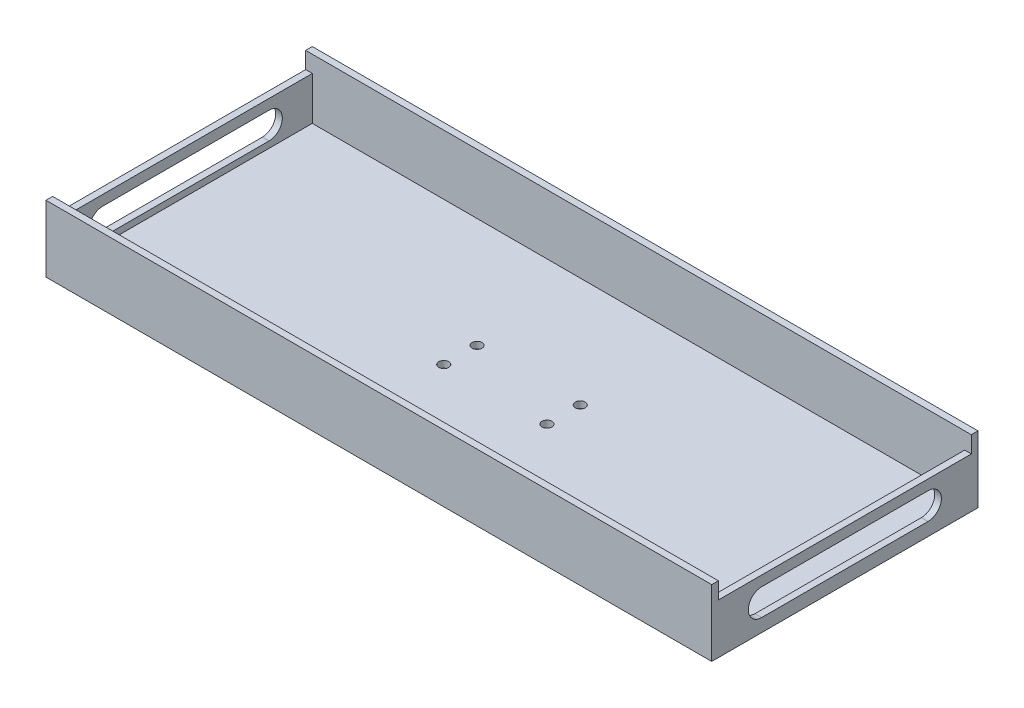
from build123d import *

# Parameters (mm, degrees)
IZIM4_W                     = 200
IZIM4_H                     = 80
Y_KSEKLIK_EKSTR_ZYON3_DEPTH = 10
BO_ALTMA1_T                 = -2
IZIM5_W                     = 76
IZIM5_H                     = 5
KES_EKSTR_ZYON1_DEPTH       = 200
IZIM8_R                     = 1.5
KES_EKSTR_ZYON3_DEPTH       = 39
KES_EKSTR_ZYON4_DEPTH       = 235
IZIM12_W                    = 1.794871794
IZIM12_H                    = 10
Y_KSEKLIK_EKSTR_ZYON4_DEPTH = 2
IZIM13_W                    = 1.794871794
IZIM13_H                    = 10
Y_KSEKLIK_EKSTR_ZYON5_DEPTH = 2


with BuildPart() as part:
    # Çizim4 → Yükseklik-Ekstrüzyon3 (new, symmetric)
    with BuildSketch(Plane(origin=(0, 0, 0), x_dir=(1, 0, 0), z_dir=(0, 1, 0))):
        with Locations((-100, 0)):
            Rectangle(IZIM4_W, IZIM4_H)
    extrude(amount=Y_KSEKLIK_EKSTR_ZYON3_DEPTH, both=True)

    # İç Boşaltma1
    bo_altma1_openings = [part.faces().sort_by_distance(p)[0] for p in [
        (-100, 10, 0),
    ]]
    offset(amount=BO_ALTMA1_T, openings=bo_altma1_openings, kind=Kind.INTERSECTION)

    # Çizim5 → Kes-Ekstrüzyon1 (cut)
    with BuildSketch(Plane(origin=(0, 0, 0), x_dir=(0, 0, -1), z_dir=(1, 0, 0))):
        with Locations((0, 7.5)):
            Rectangle(IZIM5_W, IZIM5_H)
    extrude(amount=-KES_EKSTR_ZYON1_DEPTH, mode=Mode.SUBTRACT)

    # Çizim8 → Kes-Ekstrüzyon3 (cut)
    with BuildSketch(Plane.XZ.offset(10)):
        with Locations(Location((-84.5, 5, 0), (0, 0, 270))):
            Circle(IZIM8_R)
        with Locations(Location((-84.5, -5, 0), (0, 0, 270))):
            Circle(IZIM8_R)
        with Locations(Location((-115.5, -5, 0), (0, 0, 270))):
            Circle(IZIM8_R)
        with Locations(Location((-115.5, 5, 0), (0, 0, 270))):
            Circle(IZIM8_R)
    extrude(amount=-KES_EKSTR_ZYON3_DEPTH, mode=Mode.SUBTRACT)

    # Çizim10 → Kes-Ekstrüzyon4 (cut)
    with BuildSketch(Plane(origin=(0, 0, 0), x_dir=(0, 0, -1), z_dir=(1, 0, 0))):
        with BuildLine():
            Line((25, -6.066336968), (10, -6.066336968))
            Line((10, -6.066336968), (-10, -6.066336968))
            Line((-10, -6.066336968), (-25, -6.066336968))
            ThreePointArc((-25, -6.066336968), (-29, -2.066336968), (-25, 1.933663032))
            Line((-25, 1.933663032), (-10, 1.933663032))
            Line((-10, 1.933663032), (10, 1.933663032))
            Line((10, 1.933663032), (25, 1.933663032))
            ThreePointArc((25, 1.933663032), (29, -2.066336968), (25, -6.066336968))
        make_face()
    extrude(amount=-KES_EKSTR_ZYON4_DEPTH, mode=Mode.SUBTRACT)

    # Çizim12 → Yükseklik-Ekstrüzyon4 (add)
    # profile 1 of 14: a face of its own
    with BuildSketch(Plane.XZ.offset(10)):
        with BuildLine():
            Line((-178.291749805, 30.263939108), (-179.607855574, 29.005926287))
            add(Edge.make_bspline(
                [(-179.607855574, 29.005926287), (-179.719498388, 29.121365144), (-179.937571779, 29.346853396), (-180.288970079, 29.64537997), (-180.654411516, 29.894161477), (-181.026787157, 30.103683678), (-181.41279496, 30.262202156), (-181.807971624, 30.377717241), (-182.214840468, 30.448142423), (-182.490193652, 30.45620031), (-182.628688908, 30.460253211)],
                knots=[0, 0, 0, 0, 1.115251505, 2.178435587, 3.19620269, 4.182487026, 5.141301733, 6.088180966, 7.038406374, 8, 8, 8, 8], degree=3))
            add(Edge.make_bspline(
                [(-182.628688908, 30.460253211), (-182.744349277, 30.457051277), (-182.972592272, 30.450732615), (-183.307712801, 30.404410586), (-183.628272906, 30.325637959), (-183.935369915, 30.217074689), (-184.228100182, 30.076599578), (-184.507077454, 29.904321353), (-184.771613922, 29.701795929), (-185.018215213, 29.470071183), (-185.243797408, 29.216894485), (-185.44311364, 28.946755551), (-185.610072957, 28.660273257), (-185.747093753, 28.360348882), (-185.853827656, 28.04559423), (-185.930049073, 27.716221205), (-185.974133504, 27.371837549), (-185.9807134, 27.137728106), (-185.984057497, 27.0187468)],
                knots=[0, 0, 0, 0, 1.035432265, 2.043311493, 3.022114605, 3.98653278, 4.95457646, 5.923598177, 6.917315552, 7.932509744, 8.948865224, 9.949768934, 10.933144597, 11.912367597, 12.897413939, 13.903909035, 14.934704909, 16, 16, 16, 16], degree=3))
            add(Edge.make_bspline(
                [(-185.984057497, 27.0187468), (-185.983093767, 26.935237395), (-185.981194234, 26.770638641), (-185.960400487, 26.527151402), (-185.926917652, 26.290911216), (-185.878459694, 26.062275926), (-185.817862541, 25.841047393), (-185.746768282, 25.625317091), (-185.657581581, 25.418065926), (-185.558582997, 25.21688681), (-185.443448784, 25.027269168), (-185.319312864, 24.84645301), (-185.184707725, 24.675324678), (-185.038761523, 24.51458375), (-184.879420247, 24.366742247), (-184.710802278, 24.227354398), (-184.530063265, 24.099909555), (-184.340957616, 23.981209348), (-184.141851696, 23.878093468), (-183.938147711, 23.784690402), (-183.726757097, 23.708833226), (-183.510253663, 23.647685421), (-183.289411116, 23.595688346), (-183.062069409, 23.563672148), (-182.830199312, 23.539426657), (-182.673494046, 23.537929639), (-182.59463442, 23.537176287)],
                knots=[0, 0, 0, 0, 1.103660481, 2.175337485, 3.227646561, 4.255952547, 5.262355991, 6.258840057, 7.255597736, 8.242457506, 9.22035537, 10.185017736, 11.140346927, 12.096287581, 13.051739095, 14.01125915, 14.986044842, 15.97314143, 16.960198552, 17.947847494, 18.933482797, 19.925264591, 20.920966487, 21.929612487, 22.958107872, 24, 24, 24, 24], degree=3))
            add(Edge.make_bspline(
                [(-182.59463442, 23.537176287), (-182.460874943, 23.541045321), (-182.198072354, 23.548646967), (-181.812371766, 23.608090758), (-181.444837531, 23.705872431), (-181.151179436, 23.821346906), (-180.921106075, 23.935379448), (-180.745954627, 24.040853934), (-180.564834378, 24.158838728), (-180.380753581, 24.293786702), (-180.191641693, 24.444078427), (-180.000836973, 24.613005573), (-179.803454787, 24.79500561), (-179.674151674, 24.924902613), (-179.607855574, 24.991503211)],
                knots=[0, 0, 0, 0, 1.404581149, 2.759636711, 4.088442092, 5.392261763, 6.066678138, 6.783632037, 7.538459478, 8.336747902, 9.180226004, 10.074962426, 11.012997595, 12, 12, 12, 12], degree=3))
            Line((-179.607855574, 24.991503211), (-178.331813908, 23.65135898))
            add(Edge.make_bspline(
                [(-178.331813908, 23.65135898), (-178.421512768, 23.564757546), (-178.596585762, 23.395730067), (-178.860678512, 23.155726819), (-179.124438892, 22.940057221), (-179.381494999, 22.740893412), (-179.63605768, 22.564037516), (-179.88809994, 22.409312906), (-180.134768551, 22.272806373), (-180.381185664, 22.156820031), (-180.628884615, 22.058335581), (-180.883737727, 21.973546934), (-181.146524109, 21.901818789), (-181.418848742, 21.843943596), (-181.698171547, 21.797535504), (-181.987106614, 21.76621031), (-182.283821952, 21.745151425), (-182.485088563, 21.74325911), (-182.5866216, 21.742304493)],
                knots=[0, 0, 0, 0, 1.244526981, 2.429050516, 3.560637417, 4.644440555, 5.67424972, 6.652764056, 7.595344123, 8.486817594, 9.369275933, 10.254498637, 11.166417451, 12.086725134, 13.032340136, 13.991389299, 14.986715468, 16, 16, 16, 16], degree=3))
            add(Edge.make_bspline(
                [(-182.5866216, 21.742304493), (-182.773125211, 21.747058842), (-183.138060937, 21.756361781), (-183.672864727, 21.825290264), (-184.180913972, 21.94084765), (-184.66344466, 22.104277668), (-185.120303358, 22.313051857), (-185.551373187, 22.568999209), (-185.955959359, 22.871439713), (-186.330793614, 23.216828472), (-186.669849036, 23.598281361), (-186.969534765, 24.007857116), (-187.217434811, 24.447568651), (-187.423271561, 24.910920024), (-187.584233192, 25.400025685), (-187.697522893, 25.915414699), (-187.767387825, 26.456589425), (-187.775031148, 26.826224238), (-187.778929292, 27.01474039)],
                knots=[0, 0, 0, 0, 1.078019885, 2.10938526, 3.111377082, 4.085535484, 5.04941344, 6.010039228, 6.978205633, 7.964457913, 8.951525778, 9.924444315, 10.892603023, 11.863865945, 12.85144698, 13.863884204, 14.910567087, 16, 16, 16, 16], degree=3))
            add(Edge.make_bspline(
                [(-187.778929292, 27.01474039), (-187.777282125, 27.137689016), (-187.774017843, 27.381343144), (-187.739709937, 27.740265414), (-187.69188272, 28.090150426), (-187.616009189, 28.427365214), (-187.524551131, 28.756452683), (-187.410811019, 29.073836037), (-187.274970513, 29.380427467), (-187.121408072, 29.676740226), (-186.947684419, 29.960833149), (-186.753616027, 30.230265427), (-186.544198973, 30.487117031), (-186.314401307, 30.727980345), (-186.06756229, 30.954970198), (-185.802567472, 31.166856487), (-185.521010665, 31.3666779), (-185.222129798, 31.549281529), (-184.911731332, 31.714456218), (-184.593730206, 31.860147347), (-184.268907714, 31.981911582), (-183.938637234, 32.082910522), (-183.601523378, 32.15829909), (-183.259972378, 32.215365803), (-182.911078046, 32.247266461), (-182.676825727, 32.252488803), (-182.558576728, 32.255125005)],
                knots=[0, 0, 0, 0, 1.071919942, 2.124283339, 3.142214191, 4.149696895, 5.136002878, 6.119640489, 7.086990633, 8.058538607, 9.028339693, 9.988281803, 10.952401235, 11.916291999, 12.888973767, 13.874849856, 14.873389453, 15.898127285, 16.927174885, 17.938320013, 18.946391617, 19.950418109, 20.947802303, 21.956882652, 22.968648068, 24, 24, 24, 24], degree=3))
            add(Edge.make_bspline(
                [(-182.558576728, 32.255125005), (-182.457698207, 32.253613868), (-182.256990022, 32.250607305), (-181.958101853, 32.225544332), (-181.661604052, 32.186183187), (-181.368558172, 32.126795601), (-181.076868049, 32.056295032), (-180.790366818, 31.963984261), (-180.504534768, 31.861086511), (-180.223854749, 31.738093261), (-179.947934973, 31.603835019), (-179.683239296, 31.451514168), (-179.425323501, 31.290504363), (-179.179902849, 31.111276338), (-178.942380081, 30.920331026), (-178.713997225, 30.716777562), (-178.496758474, 30.49722211), (-178.360431496, 30.342093223), (-178.291749805, 30.263939108)],
                knots=[0, 0, 0, 0, 0.996412454, 1.982464992, 2.961075852, 3.949442424, 4.934965278, 5.923860011, 6.921385422, 7.934793307, 8.949617135, 9.951082467, 10.950285876, 11.951772932, 12.951063433, 13.960125323, 14.972308753, 16, 16, 16, 16], degree=3))
        make_face()
    # profile 2 of 14: a face of its own
    with BuildSketch(Plane.XZ.offset(10)):
        with BuildLine():
            Line((-176.49687801, 31.998714749), (-174.405531856, 31.998714749))
            add(Edge.make_bspline(
                [(-174.405531856, 31.998714749), (-174.267294512, 31.998224086), (-174.00142516, 31.997280402), (-173.618056075, 31.982391574), (-173.26587885, 31.961672549), (-172.944372052, 31.930054765), (-172.653673229, 31.888133406), (-172.393491031, 31.838715061), (-172.163833065, 31.782392262), (-171.962762481, 31.712209611), (-171.781306223, 31.633044644), (-171.612163762, 31.542082646), (-171.451603566, 31.440336506), (-171.300698806, 31.325129009), (-171.158138083, 31.198532709), (-171.023652448, 31.060420175), (-170.899142309, 30.909620269), (-170.785378637, 30.747085855), (-170.681692207, 30.576103378), (-170.59005515, 30.396438079), (-170.515535742, 30.207965012), (-170.449689858, 30.013408021), (-170.4022632, 29.809985875), (-170.369278654, 29.599678924), (-170.345128659, 29.381746863), (-170.34374015, 29.233693498), (-170.343031856, 29.158169877)],
                knots=[0, 0, 0, 0, 1.749336639, 3.364467119, 4.854658419, 6.213483162, 7.451590619, 8.570285859, 9.5643256, 10.440900261, 11.26203566, 12.067320669, 12.869050712, 13.665104639, 14.467235401, 15.27997916, 16.102287765, 16.939272006, 17.78853747, 18.631303466, 19.488103222, 20.351255419, 21.228522269, 22.127379805, 23.044756219, 24, 24, 24, 24], degree=3))
            add(Edge.make_bspline(
                [(-170.343031856, 29.158169877), (-170.344871748, 29.079340567), (-170.348479441, 28.924770657), (-170.367912437, 28.697720066), (-170.403429849, 28.480493941), (-170.457226136, 28.273728296), (-170.519057981, 28.074849689), (-170.601278474, 27.887527555), (-170.694072426, 27.709037567), (-170.804281092, 27.541904531), (-170.92522972, 27.38241609), (-171.065890429, 27.236682836), (-171.217150566, 27.096872161), (-171.387513016, 26.97174133), (-171.569468043, 26.852829448), (-171.766630901, 26.745063616), (-171.977714839, 26.645734848), (-172.126117301, 26.590342266), (-172.202006215, 26.562016031)],
                knots=[0, 0, 0, 0, 1.099860209, 2.156625411, 3.176576793, 4.16617041, 5.135385252, 6.078461593, 7.016046972, 7.938469504, 8.868247731, 9.803980173, 10.76021508, 11.73834243, 12.748633912, 13.790971185, 14.870363756, 16, 16, 16, 16], degree=3))
            Line((-172.202006215, 26.562016031), (-169.894313908, 21.998714749))
            Line((-169.894313908, 21.998714749), (-171.889506215, 21.998714749))
            Line((-171.889506215, 21.998714749), (-174.093031856, 26.357689108))
            Line((-174.093031856, 26.357689108), (-174.702006215, 26.357689108))
            Line((-174.702006215, 26.357689108), (-174.702006215, 21.998714749))
            Line((-174.702006215, 21.998714749), (-176.49687801, 21.998714749))
            Line((-176.49687801, 21.998714749), (-176.49687801, 31.998714749))
        make_face()
        with BuildLine():
            Line((-174.702006215, 28.152560903), (-174.002887625, 28.152560903))
            add(Edge.make_bspline(
                [(-174.002887625, 28.152560903), (-173.917414566, 28.153523558), (-173.753752024, 28.155366835), (-173.518383793, 28.163916721), (-173.304613307, 28.18451772), (-173.111522563, 28.210546312), (-172.938139946, 28.24060008), (-172.786011968, 28.283668955), (-172.65279457, 28.329818345), (-172.540066381, 28.387170065), (-172.443754007, 28.45239141), (-172.360594437, 28.526484479), (-172.291809548, 28.612237772), (-172.235196077, 28.707320884), (-172.191156951, 28.812574802), (-172.159011763, 28.926844077), (-172.141047356, 29.051430383), (-172.13898049, 29.137411897), (-172.137903651, 29.182208339)],
                knots=[0, 0, 0, 0, 1.688639943, 3.233382647, 4.650958383, 5.928841754, 7.082724185, 8.122798841, 9.049171256, 9.863274652, 10.613301712, 11.341792392, 12.054588806, 12.776240173, 13.521029143, 14.301969904, 15.115324896, 16, 16, 16, 16], degree=3))
            add(Edge.make_bspline(
                [(-172.137903651, 29.182208339), (-172.139939514, 29.235205799), (-172.143938589, 29.339309489), (-172.183621839, 29.489182299), (-172.246789001, 29.627899839), (-172.333373879, 29.754835349), (-172.442416276, 29.866115779), (-172.56755103, 29.964210364), (-172.71147885, 30.041776223), (-172.844745181, 30.092937837), (-172.965986392, 30.123548359), (-173.075402761, 30.146359049), (-173.202107574, 30.162525639), (-173.346196487, 30.179673186), (-173.507302213, 30.190792503), (-173.686302874, 30.198907387), (-173.882684381, 30.202227585), (-174.019580944, 30.203288994), (-174.091028651, 30.203842954)],
                knots=[0, 0, 0, 0, 1.020303359, 2.004196876, 2.966617323, 3.9489082, 4.950758222, 5.960522915, 7.003732012, 8.091992268, 8.70421221, 9.413913587, 10.24622431, 11.166358409, 12.212345909, 13.359657661, 14.621978493, 16, 16, 16, 16], degree=3))
            Line((-174.091028651, 30.203842954), (-174.702006215, 30.203842954))
            Line((-174.702006215, 30.203842954), (-174.702006215, 28.152560903))
        make_face(mode=Mode.SUBTRACT)
    # profile 3 of 14: a face of its own
    with BuildSketch(Plane.XZ.offset(10)):
        Polygon((-168.419954933, 31.998714749), (-163.035339549, 31.998714749), (-163.035339549, 30.203842954), (-166.625083138, 30.203842954), (-166.625083138, 28.280766031), (-163.035339549, 28.280766031), (-163.035339549, 26.485894236), (-166.625083138, 26.485894236), (-166.625083138, 23.793586544), (-163.035339549, 23.793586544), (-163.035339549, 21.998714749), (-168.419954933, 21.998714749), align=None)
    # profile 4 of 14: a face of its own
    with BuildSketch(Plane.XZ.offset(10)):
        Polygon((-158.161541472, 31.998714749), (-156.49687801, 31.998714749), (-152.458416472, 21.998714749), (-154.375483779, 21.998714749), (-155.152727369, 24.0499968), (-159.509698523, 24.0499968), (-160.286942113, 21.998714749), (-162.202006215, 21.998714749), align=None)
        Polygon((-157.330211343, 29.316423082), (-158.828608779, 25.844868595), (-155.831813908, 25.844868595), align=None, mode=Mode.SUBTRACT)
    # profile 5 of 14: a face of its own
    with BuildSketch(Plane.XZ.offset(10)):
        Polygon((-152.009698523, 31.998714749), (-146.625083138, 31.998714749), (-146.625083138, 30.203842954), (-148.419954933, 30.203842954), (-148.419954933, 21.998714749), (-150.214826728, 21.998714749), (-150.214826728, 30.203842954), (-152.009698523, 30.203842954), align=None)
    # profile 6 of 14: a face of its own
    with BuildSketch(Plane.XZ.offset(10)):
        with Locations((-144.573801087, 26.998714749)):
            Rectangle(IZIM12_W, IZIM12_H)
    # profile 7 of 14: a face of its own
    with BuildSketch(Plane.XZ.offset(10)):
        with BuildLine():
            add(Edge.make_bspline(
                [(-144.513704933, 34.691022441), (-144.448573747, 34.687596772), (-144.32145146, 34.680910591), (-144.138823558, 34.627135952), (-143.972712886, 34.536467534), (-143.82691729, 34.412236182), (-143.703337377, 34.266790801), (-143.611996241, 34.102498099), (-143.558484735, 33.922404318), (-143.551646248, 33.797278289), (-143.548160061, 33.73349039)],
                knots=[0, 0, 0, 0, 1.033757622, 2.017676021, 2.99585523, 4.020311853, 5.044768476, 6.013636162, 6.987373143, 8, 8, 8, 8], degree=3))
            add(Edge.make_bspline(
                [(-143.548160061, 33.73349039), (-143.55155744, 33.668345343), (-143.558188405, 33.541196004), (-143.612529963, 33.358194509), (-143.702133117, 33.190893129), (-143.826405404, 33.044680627), (-143.97338128, 32.922666942), (-144.138746843, 32.831733878), (-144.321471826, 32.778083419), (-144.448580646, 32.771380013), (-144.513704933, 32.767945518)],
                knots=[0, 0, 0, 0, 1.028208009, 2.006844351, 2.989059939, 4.008016881, 5.020227687, 5.993155649, 6.971791991, 8, 8, 8, 8], degree=3))
            add(Edge.make_bspline(
                [(-144.513704933, 32.767945518), (-144.577499292, 32.771412703), (-144.702637991, 32.778213916), (-144.883206847, 32.832165769), (-145.04791471, 32.922722718), (-145.195114112, 33.044039954), (-145.317070933, 33.191600732), (-145.406970705, 33.358108428), (-145.46118124, 33.541218766), (-145.467830323, 33.668353054), (-145.471236984, 33.73349039)],
                knots=[0, 0, 0, 0, 1.011983718, 1.98510226, 2.962660208, 3.97968794, 4.996715672, 5.983605444, 6.966898937, 8, 8, 8, 8], degree=3))
            add(Edge.make_bspline(
                [(-145.471236984, 33.73349039), (-145.467741767, 33.797270798), (-145.460885567, 33.922382132), (-145.407502791, 34.102582703), (-145.315879569, 34.266092617), (-145.194608785, 34.412883389), (-145.048583022, 34.536412085), (-144.883130961, 34.626705118), (-144.702657812, 34.680779398), (-144.577505985, 34.687563817), (-144.513704933, 34.691022441)],
                knots=[0, 0, 0, 0, 1.017471896, 1.995867844, 2.969371198, 3.991914463, 5.021272727, 6.004132156, 6.982528104, 8, 8, 8, 8], degree=3))
        make_face()
    # profile 8 of 14: a face of its own
    with BuildSketch(Plane.XZ.offset(10)):
        Polygon((-141.368672882, 31.998714749), (-139.752086343, 31.998714749), (-135.214826728, 25.418185903), (-135.214826728, 31.998714749), (-133.419954933, 31.998714749), (-133.419954933, 21.998714749), (-135.048560702, 21.998714749), (-139.573801087, 28.559211544), (-139.573801087, 21.998714749), (-141.368672882, 21.998714749), align=None)
    # profile 9 of 14: a face of its own
    with BuildSketch(Plane.XZ.offset(10)):
        Polygon((-131.945595959, 31.998714749), (-129.948400446, 31.998714749), (-128.163544677, 28.49110257), (-126.378688908, 31.998714749), (-124.381493395, 31.998714749), (-127.266108779, 26.329644236), (-127.266108779, 21.998714749), (-129.060980574, 21.998714749), (-129.060980574, 26.329644236), align=None)
    # profile 10 of 14: a face of its own
    with BuildSketch(Plane.XZ.offset(10)):
        Polygon((-69.443592754, 31.998714749), (-67.778929292, 31.998714749), (-63.740467754, 21.998714749), (-65.657535061, 21.998714749), (-66.434778651, 24.0499968), (-70.791749805, 24.0499968), (-71.568993395, 21.998714749), (-73.484057497, 21.998714749), align=None)
        Polygon((-68.612262625, 29.316423082), (-70.110660061, 25.844868595), (-67.11386519, 25.844868595), align=None, mode=Mode.SUBTRACT)
    # profile 11 of 14: a face of its own
    with BuildSketch(Plane.XZ.offset(10)):
        with BuildLine():
            Line((-62.266108779, 31.998714749), (-60.00449019, 31.998714749))
            add(Edge.make_bspline(
                [(-60.00449019, 31.998714749), (-59.828171007, 31.997482218), (-59.487344034, 31.99509972), (-58.993553178, 31.968254707), (-58.534390517, 31.926968981), (-58.109560067, 31.870172984), (-57.719932799, 31.795016327), (-57.366011129, 31.70074703), (-57.046607211, 31.59192881), (-56.758218848, 31.463882093), (-56.49494801, 31.314592338), (-56.244963948, 31.148295536), (-56.008757498, 30.958899749), (-55.783013877, 30.750058801), (-55.570646354, 30.517952009), (-55.368118249, 30.266423903), (-55.18038837, 29.991826979), (-55.001782047, 29.700745204), (-54.840256395, 29.391945003), (-54.699367685, 29.068054818), (-54.581344358, 28.731159003), (-54.485444294, 28.380898515), (-54.409000874, 28.018436111), (-54.355514954, 27.643040378), (-54.322449426, 27.255058869), (-54.319095205, 26.99210475), (-54.317390831, 26.85849039)],
                knots=[0, 0, 0, 0, 1.44355588, 2.790409838, 4.047694926, 5.217575253, 6.298404546, 7.294384826, 8.214239204, 9.058592145, 9.873746385, 10.689560431, 11.514393297, 12.350027578, 13.205127629, 14.088021785, 14.991911688, 15.926770944, 16.882954281, 17.842803888, 18.816321264, 19.80318086, 20.814351908, 21.847355356, 22.906180909, 24, 24, 24, 24], degree=3))
            add(Edge.make_bspline(
                [(-54.317390831, 26.85849039), (-54.321853802, 26.669951832), (-54.330639421, 26.298802643), (-54.404644574, 25.754145484), (-54.524335965, 25.232037274), (-54.692632931, 24.736562147), (-54.901276117, 24.272132379), (-55.150523767, 23.846937997), (-55.436721328, 23.463261228), (-55.756534584, 23.123012467), (-56.102814449, 22.830564046), (-56.462669057, 22.580103375), (-56.839604047, 22.382594236), (-57.171736452, 22.257343907), (-57.459736682, 22.179449038), (-57.712597769, 22.133412421), (-57.999822163, 22.091194066), (-58.324087983, 22.05856863), (-58.683972744, 22.029474758), (-59.080910952, 22.013666281), (-59.513617435, 22.000531783), (-59.814173, 21.999336297), (-59.970435702, 21.998714749)],
                knots=[0, 0, 0, 0, 1.315458931, 2.589557908, 3.828601765, 5.048913369, 6.235739168, 7.376350998, 8.481830359, 9.569842114, 10.627874879, 11.640079404, 12.624025415, 13.590060155, 14.111227486, 14.704434459, 15.382649715, 16.137166398, 16.978595427, 17.902333227, 18.909396075, 20, 20, 20, 20], degree=3))
            Line((-59.970435702, 21.998714749), (-62.266108779, 21.998714749))
            Line((-62.266108779, 21.998714749), (-62.266108779, 31.998714749))
        make_face()
        with BuildLine():
            Line((-60.471236984, 30.203842954), (-60.471236984, 23.793586544))
            Line((-60.471236984, 23.793586544), (-59.533736984, 23.793586544))
            add(Edge.make_bspline(
                [(-59.533736984, 23.793586544), (-59.422188882, 23.793790946), (-59.207644747, 23.79418408), (-58.89789158, 23.812909376), (-58.611448441, 23.83170441), (-58.349103841, 23.867378013), (-58.108948517, 23.907115897), (-57.894281575, 23.962416602), (-57.700677795, 24.020505309), (-57.530502012, 24.094459433), (-57.37463486, 24.177699721), (-57.230319681, 24.275225368), (-57.091015129, 24.383523922), (-56.959325613, 24.505780596), (-56.834752721, 24.640376482), (-56.718033506, 24.788005094), (-56.607610074, 24.948216012), (-56.506316785, 25.12185631), (-56.413754436, 25.307092309), (-56.33164126, 25.502129727), (-56.263557321, 25.708592807), (-56.206970118, 25.924548804), (-56.166532146, 26.151877862), (-56.133077437, 26.388896186), (-56.115830559, 26.636542822), (-56.113463533, 26.80504987), (-56.112262625, 26.890541672)],
                knots=[0, 0, 0, 0, 1.50275155, 2.890291501, 4.180787663, 5.369391935, 6.45668281, 7.458360028, 8.354766181, 9.177074746, 9.954075863, 10.732690366, 11.5210699, 12.329727389, 13.151100085, 13.990027547, 14.863562427, 15.770965086, 16.696477834, 17.652329173, 18.619756807, 19.62365428, 20.657822005, 21.729286259, 22.847956731, 24, 24, 24, 24], degree=3))
            add(Edge.make_bspline(
                [(-56.112262625, 26.890541672), (-56.114654425, 27.021549777), (-56.11931825, 27.277005431), (-56.164295161, 27.649082167), (-56.237508994, 27.999448153), (-56.341978079, 28.326803088), (-56.473664598, 28.632067011), (-56.638500974, 28.912653689), (-56.829393283, 29.173276592), (-56.980345714, 29.32616635), (-57.055772241, 29.402560903)],
                knots=[0, 0, 0, 0, 1.13821349, 2.219428113, 3.251817212, 4.244760574, 5.201143372, 6.134805572, 7.068016741, 8, 8, 8, 8], degree=3))
            add(Edge.make_bspline(
                [(-57.055772241, 29.402560903), (-57.130149938, 29.46765939), (-57.282057964, 29.600615677), (-57.548758537, 29.759931312), (-57.842648756, 29.899905712), (-58.170451948, 30.010889802), (-58.52900004, 30.098660751), (-58.920428552, 30.159194228), (-59.342641301, 30.198092399), (-59.635140455, 30.201885036), (-59.786140831, 30.203842954)],
                knots=[0, 0, 0, 0, 0.813307809, 1.661089106, 2.549956539, 3.493439533, 4.508053171, 5.589449661, 6.755572447, 8, 8, 8, 8], degree=3))
            Line((-59.786140831, 30.203842954), (-60.471236984, 30.203842954))
        make_face(mode=Mode.SUBTRACT)
    # profile 12 of 14: a face of its own
    with BuildSketch(Plane.XZ.offset(10)):
        Polygon((-49.443592754, 31.998714749), (-47.778929292, 31.998714749), (-43.740467754, 21.998714749), (-45.657535061, 21.998714749), (-46.434778651, 24.0499968), (-50.791749805, 24.0499968), (-51.568993395, 21.998714749), (-53.484057497, 21.998714749), align=None)
        Polygon((-48.612262625, 29.316423082), (-50.110660061, 25.844868595), (-47.11386519, 25.844868595), align=None, mode=Mode.SUBTRACT)
    # profile 13 of 14: a face of its own
    with BuildSketch(Plane.XZ.offset(10)):
        Polygon((-42.266108779, 31.998714749), (-40.649522241, 31.998714749), (-36.112262625, 25.418185903), (-36.112262625, 31.998714749), (-34.317390831, 31.998714749), (-34.317390831, 21.998714749), (-35.9459966, 21.998714749), (-40.471236984, 28.559211544), (-40.471236984, 21.998714749), (-42.266108779, 21.998714749), align=None)
    # profile 14 of 14: a face of its own
    with BuildSketch(Plane.XZ.offset(10)):
        Polygon((-28.930772241, 31.998714749), (-27.266108779, 31.998714749), (-23.227647241, 21.998714749), (-25.144714549, 21.998714749), (-25.921958138, 24.0499968), (-30.278929292, 24.0499968), (-31.056172882, 21.998714749), (-32.971236984, 21.998714749), align=None)
        Polygon((-28.099442113, 29.316423082), (-29.597839549, 25.844868595), (-26.601044677, 25.844868595), align=None, mode=Mode.SUBTRACT)
    extrude(amount=Y_KSEKLIK_EKSTR_ZYON4_DEPTH)

    # Çizim13 → Yükseklik-Ekstrüzyon5 (add)
    # profile 1 of 16: a face of its own
    with BuildSketch(Plane(origin=(0, -12, 0), x_dir=(1, 0, 0), z_dir=(0, 1, 0))):
        with BuildLine():
            Line((-22.816668425, 26.818301618), (-21.500562656, 25.560288798))
            add(Edge.make_bspline(
                [(-21.500562656, 25.560288798), (-21.388919842, 25.675727654), (-21.170846451, 25.901215906), (-20.819448151, 26.19974248), (-20.454006714, 26.448523987), (-20.081631073, 26.658046188), (-19.69562327, 26.816564666), (-19.300446606, 26.932079752), (-18.893577762, 27.002504933), (-18.618224579, 27.01056282), (-18.479729322, 27.014615721)],
                knots=[0, 0, 0, 0, 1.115251505, 2.178435587, 3.19620269, 4.182487026, 5.141301733, 6.088180966, 7.038406374, 8, 8, 8, 8], degree=3))
            add(Edge.make_bspline(
                [(-18.479729322, 27.014615721), (-18.364068953, 27.011413787), (-18.135825958, 27.005095125), (-17.800705429, 26.958773096), (-17.480145324, 26.880000469), (-17.173048315, 26.771437199), (-16.880318048, 26.630962089), (-16.601340776, 26.458683863), (-16.336804308, 26.256158439), (-16.090203017, 26.024433693), (-15.864620822, 25.771256995), (-15.66530459, 25.501118062), (-15.498345273, 25.214635767), (-15.361324477, 24.914711392), (-15.254590574, 24.59995674), (-15.178369157, 24.270583715), (-15.134284726, 23.926200059), (-15.12770483, 23.692090616), (-15.124360733, 23.57310931)],
                knots=[0, 0, 0, 0, 1.035432265, 2.043311493, 3.022114605, 3.98653278, 4.95457646, 5.923598177, 6.917315552, 7.932509744, 8.948865224, 9.949768934, 10.933144597, 11.912367597, 12.897413939, 13.903909035, 14.934704909, 16, 16, 16, 16], degree=3))
            add(Edge.make_bspline(
                [(-15.124360733, 23.57310931), (-15.125324463, 23.489599905), (-15.127223996, 23.325001151), (-15.148017743, 23.081513912), (-15.181500578, 22.845273727), (-15.229958536, 22.616638436), (-15.290555689, 22.395409903), (-15.361649948, 22.179679601), (-15.450836649, 21.972428436), (-15.549835233, 21.77124932), (-15.664969446, 21.581631679), (-15.789105366, 21.40081552), (-15.923710505, 21.229687188), (-16.069656707, 21.06894626), (-16.228997983, 20.921104757), (-16.397615952, 20.781716909), (-16.578354965, 20.654272065), (-16.767460614, 20.535571858), (-16.966566534, 20.432455978), (-17.170270519, 20.339052912), (-17.381661133, 20.263195736), (-17.598164567, 20.202047931), (-17.819007114, 20.150050856), (-18.046348821, 20.118034659), (-18.278218918, 20.093789167), (-18.434924184, 20.09229215), (-18.51378381, 20.091538798)],
                knots=[0, 0, 0, 0, 1.103660481, 2.175337485, 3.227646561, 4.255952547, 5.262355991, 6.258840057, 7.255597736, 8.242457506, 9.22035537, 10.185017736, 11.140346927, 12.096287581, 13.051739095, 14.01125915, 14.986044842, 15.97314143, 16.960198552, 17.947847494, 18.933482797, 19.925264591, 20.920966487, 21.929612487, 22.958107872, 24, 24, 24, 24], degree=3))
            add(Edge.make_bspline(
                [(-18.51378381, 20.091538798), (-18.647543287, 20.095407831), (-18.910345876, 20.103009477), (-19.296046464, 20.162453268), (-19.663580699, 20.260234942), (-19.957238794, 20.375709416), (-20.187312155, 20.489741958), (-20.362463603, 20.595216444), (-20.543583852, 20.713201238), (-20.727664649, 20.848149212), (-20.916776537, 20.998440937), (-21.107581257, 21.167368083), (-21.304963443, 21.34936812), (-21.434266556, 21.479265123), (-21.500562656, 21.545865721)],
                knots=[0, 0, 0, 0, 1.404581149, 2.759636711, 4.088442092, 5.392261763, 6.066678138, 6.783632037, 7.538459478, 8.336747902, 9.180226004, 10.074962426, 11.012997595, 12, 12, 12, 12], degree=3))
            Line((-21.500562656, 21.545865721), (-22.776604322, 20.20572149))
            add(Edge.make_bspline(
                [(-22.776604322, 20.20572149), (-22.686905462, 20.119120056), (-22.511832468, 19.950092577), (-22.247739718, 19.71008933), (-21.983979338, 19.494419732), (-21.726923231, 19.295255922), (-21.47236055, 19.118400026), (-21.22031829, 18.963675416), (-20.973649679, 18.827168883), (-20.727232566, 18.711182541), (-20.479533615, 18.612698091), (-20.224680504, 18.527909444), (-19.961894121, 18.456181299), (-19.689569488, 18.398306106), (-19.410246683, 18.351898014), (-19.121311616, 18.32057282), (-18.824596278, 18.299513935), (-18.623329667, 18.29762162), (-18.52179663, 18.296667003)],
                knots=[0, 0, 0, 0, 1.244526981, 2.429050516, 3.560637417, 4.644440555, 5.67424972, 6.652764056, 7.595344123, 8.486817594, 9.369275933, 10.254498637, 11.166417451, 12.086725134, 13.032340136, 13.991389299, 14.986715468, 16, 16, 16, 16], degree=3))
            add(Edge.make_bspline(
                [(-18.52179663, 18.296667003), (-18.335293019, 18.301421352), (-17.970357293, 18.310724291), (-17.435553503, 18.379652774), (-16.927504258, 18.49521016), (-16.44497357, 18.658640178), (-15.988114872, 18.867414367), (-15.557045043, 19.123361719), (-15.152458871, 19.425802223), (-14.777624616, 19.771190982), (-14.438569194, 20.152643871), (-14.138883465, 20.562219626), (-13.890983419, 21.001931162), (-13.685146669, 21.465282534), (-13.524185038, 21.954388195), (-13.410895337, 22.469777209), (-13.341030405, 23.010951935), (-13.333387082, 23.380586748), (-13.329488938, 23.5691029)],
                knots=[0, 0, 0, 0, 1.078019885, 2.10938526, 3.111377082, 4.085535484, 5.04941344, 6.010039228, 6.978205633, 7.964457913, 8.951525778, 9.924444315, 10.892603023, 11.863865945, 12.85144698, 13.863884204, 14.910567087, 16, 16, 16, 16], degree=3))
            add(Edge.make_bspline(
                [(-13.329488938, 23.5691029), (-13.331136105, 23.692051526), (-13.334400387, 23.935705654), (-13.368708294, 24.294627924), (-13.41653551, 24.644512936), (-13.492409041, 24.981727724), (-13.583867099, 25.310815193), (-13.697607211, 25.628198547), (-13.833447717, 25.934789977), (-13.987010158, 26.231102737), (-14.160733811, 26.515195659), (-14.354802203, 26.784627938), (-14.564219257, 27.041479541), (-14.794016923, 27.282342855), (-15.04085594, 27.509332708), (-15.305850758, 27.721218997), (-15.587407565, 27.92104041), (-15.886288432, 28.10364404), (-16.196686898, 28.268818728), (-16.514688024, 28.414509858), (-16.839510516, 28.536274092), (-17.169780996, 28.637273032), (-17.506894852, 28.7126616), (-17.848445852, 28.769728314), (-18.197340184, 28.801628971), (-18.431592503, 28.806851313), (-18.549841502, 28.809487516)],
                knots=[0, 0, 0, 0, 1.071919942, 2.124283339, 3.142214191, 4.149696895, 5.136002878, 6.119640489, 7.086990633, 8.058538607, 9.028339693, 9.988281803, 10.952401235, 11.916291999, 12.888973767, 13.874849856, 14.873389453, 15.898127285, 16.927174885, 17.938320013, 18.946391617, 19.950418109, 20.947802303, 21.956882652, 22.968648068, 24, 24, 24, 24], degree=3))
            add(Edge.make_bspline(
                [(-18.549841502, 28.809487516), (-18.650720023, 28.807976378), (-18.851428208, 28.804969815), (-19.150316377, 28.779906843), (-19.446814178, 28.740545697), (-19.739860058, 28.681158111), (-20.031550181, 28.610657542), (-20.318051412, 28.518346771), (-20.603883462, 28.415449021), (-20.884563481, 28.292455772), (-21.160483257, 28.15819753), (-21.425178934, 28.005876678), (-21.683094729, 27.844866873), (-21.928515381, 27.665638848), (-22.166038149, 27.474693537), (-22.394421005, 27.271140072), (-22.611659756, 27.05158462), (-22.747986734, 26.896455733), (-22.816668425, 26.818301618)],
                knots=[0, 0, 0, 0, 0.996412454, 1.982464992, 2.961075852, 3.949442424, 4.934965278, 5.923860011, 6.921385422, 7.934793307, 8.949617135, 9.951082467, 10.950285876, 11.951772932, 12.951063433, 13.960125323, 14.972308753, 16, 16, 16, 16], degree=3))
        make_face()
    # profile 2 of 16: a face of its own
    with BuildSketch(Plane(origin=(0, -12, 0), x_dir=(1, 0, 0), z_dir=(0, 1, 0))):
        with BuildLine():
            Line((-24.61154022, 28.553077259), (-26.702886374, 28.553077259))
            add(Edge.make_bspline(
                [(-26.702886374, 28.553077259), (-26.841123718, 28.552586596), (-27.10699307, 28.551642912), (-27.490362155, 28.536754085), (-27.84253938, 28.516035059), (-28.164046178, 28.484417275), (-28.454745001, 28.442495917), (-28.714927199, 28.393077572), (-28.944585165, 28.336754772), (-29.145655749, 28.266572121), (-29.327112007, 28.187407154), (-29.496254468, 28.096445156), (-29.656814664, 27.994699016), (-29.807719424, 27.879491519), (-29.950280147, 27.752895219), (-30.084765782, 27.614782685), (-30.209275921, 27.463982779), (-30.323039593, 27.301448365), (-30.426726023, 27.130465888), (-30.51836308, 26.950800589), (-30.592882488, 26.762327523), (-30.658728372, 26.567770531), (-30.70615503, 26.364348386), (-30.739139576, 26.154041434), (-30.763289571, 25.936109373), (-30.76467808, 25.788056008), (-30.765386374, 25.712532387)],
                knots=[0, 0, 0, 0, 1.749336639, 3.364467119, 4.854658419, 6.213483162, 7.451590619, 8.570285859, 9.5643256, 10.440900261, 11.26203566, 12.067320669, 12.869050712, 13.665104639, 14.467235401, 15.27997916, 16.102287765, 16.939272006, 17.78853747, 18.631303466, 19.488103222, 20.351255419, 21.228522269, 22.127379805, 23.044756219, 24, 24, 24, 24], degree=3))
            add(Edge.make_bspline(
                [(-30.765386374, 25.712532387), (-30.763546482, 25.633703077), (-30.759938789, 25.479133167), (-30.740505793, 25.252082576), (-30.704988381, 25.034856452), (-30.651192094, 24.828090806), (-30.589360249, 24.629212199), (-30.507139756, 24.441890066), (-30.414345804, 24.263400077), (-30.304137138, 24.096267041), (-30.183188511, 23.9367786), (-30.042527801, 23.791045347), (-29.891267664, 23.651234671), (-29.720905214, 23.52610384), (-29.538950187, 23.407191958), (-29.341787329, 23.299426126), (-29.130703391, 23.200097358), (-28.98230093, 23.144704776), (-28.906412015, 23.116378541)],
                knots=[0, 0, 0, 0, 1.099860209, 2.156625411, 3.176576793, 4.16617041, 5.135385252, 6.078461593, 7.016046972, 7.938469504, 8.868247731, 9.803980173, 10.76021508, 11.73834243, 12.748633912, 13.790971185, 14.870363756, 16, 16, 16, 16], degree=3))
            Line((-28.906412015, 23.116378541), (-31.214104322, 18.553077259))
            Line((-31.214104322, 18.553077259), (-29.218912015, 18.553077259))
            Line((-29.218912015, 18.553077259), (-27.015386374, 22.912051618))
            Line((-27.015386374, 22.912051618), (-26.406412015, 22.912051618))
            Line((-26.406412015, 22.912051618), (-26.406412015, 18.553077259))
            Line((-26.406412015, 18.553077259), (-24.61154022, 18.553077259))
            Line((-24.61154022, 18.553077259), (-24.61154022, 28.553077259))
        make_face()
        with BuildLine():
            Line((-26.406412015, 24.706923413), (-27.105530605, 24.706923413))
            add(Edge.make_bspline(
                [(-27.105530605, 24.706923413), (-27.191003664, 24.707886068), (-27.354666206, 24.709729346), (-27.590034437, 24.718279231), (-27.803804923, 24.73888023), (-27.996895667, 24.764908822), (-28.170278284, 24.79496259), (-28.322406262, 24.838031465), (-28.45562366, 24.884180855), (-28.568351849, 24.941532575), (-28.664664223, 25.00675392), (-28.747823793, 25.080846989), (-28.816608682, 25.166600282), (-28.873222153, 25.261683394), (-28.917261279, 25.366937312), (-28.949406467, 25.481206587), (-28.967370874, 25.605792893), (-28.96943774, 25.691774408), (-28.970514579, 25.736570849)],
                knots=[0, 0, 0, 0, 1.688639943, 3.233382647, 4.650958383, 5.928841754, 7.082724185, 8.122798841, 9.049171256, 9.863274652, 10.613301712, 11.341792392, 12.054588806, 12.776240173, 13.521029143, 14.301969904, 15.115324896, 16, 16, 16, 16], degree=3))
            add(Edge.make_bspline(
                [(-28.970514579, 25.736570849), (-28.968478716, 25.789568309), (-28.964479641, 25.893671999), (-28.924796391, 26.043544809), (-28.861629229, 26.182262349), (-28.775044351, 26.309197859), (-28.666001954, 26.420478289), (-28.5408672, 26.518572875), (-28.39693938, 26.596138733), (-28.263673049, 26.647300347), (-28.142431838, 26.677910869), (-28.033015469, 26.700721559), (-27.906310656, 26.716888149), (-27.762221743, 26.734035697), (-27.601116017, 26.745155013), (-27.422115356, 26.753269898), (-27.225733849, 26.756590095), (-27.088837286, 26.757651504), (-27.017389579, 26.758205464)],
                knots=[0, 0, 0, 0, 1.020303359, 2.004196876, 2.966617323, 3.9489082, 4.950758222, 5.960522915, 7.003732012, 8.091992268, 8.70421221, 9.413913587, 10.24622431, 11.166358409, 12.212345909, 13.359657661, 14.621978493, 16, 16, 16, 16], degree=3))
            Line((-27.017389579, 26.758205464), (-26.406412015, 26.758205464))
            Line((-26.406412015, 26.758205464), (-26.406412015, 24.706923413))
        make_face(mode=Mode.SUBTRACT)
    # profile 3 of 16: a face of its own
    with BuildSketch(Plane(origin=(0, -12, 0), x_dir=(1, 0, 0), z_dir=(0, 1, 0))):
        Polygon((-32.688463297, 28.553077259), (-38.073078681, 28.553077259), (-38.073078681, 26.758205464), (-34.483335092, 26.758205464), (-34.483335092, 24.835128541), (-38.073078681, 24.835128541), (-38.073078681, 23.040256746), (-34.483335092, 23.040256746), (-34.483335092, 20.347949054), (-38.073078681, 20.347949054), (-38.073078681, 18.553077259), (-32.688463297, 18.553077259), align=None)
    # profile 4 of 16: a face of its own
    with BuildSketch(Plane(origin=(0, -12, 0), x_dir=(1, 0, 0), z_dir=(0, 1, 0))):
        Polygon((-42.946876758, 28.553077259), (-44.61154022, 28.553077259), (-48.650001758, 18.553077259), (-46.732934451, 18.553077259), (-45.955690861, 20.60435931), (-41.598719707, 20.60435931), (-40.821476117, 18.553077259), (-38.906412015, 18.553077259), align=None)
        Polygon((-43.778206887, 25.870785592), (-42.279809451, 22.399231105), (-45.276604322, 22.399231105), align=None, mode=Mode.SUBTRACT)
    # profile 5 of 16: a face of its own
    with BuildSketch(Plane(origin=(0, -12, 0), x_dir=(1, 0, 0), z_dir=(0, 1, 0))):
        Polygon((-49.098719707, 28.553077259), (-54.483335092, 28.553077259), (-54.483335092, 26.758205464), (-52.688463297, 26.758205464), (-52.688463297, 18.553077259), (-50.893591502, 18.553077259), (-50.893591502, 26.758205464), (-49.098719707, 26.758205464), align=None)
    # profile 6 of 16: a face of its own
    with BuildSketch(Plane(origin=(0, -12, 0), x_dir=(1, 0, 0), z_dir=(0, 1, 0))):
        with Locations((-56.534617143, 23.553077259)):
            Rectangle(IZIM13_W, IZIM13_H)
    # profile 7 of 16: a face of its own
    with BuildSketch(Plane(origin=(0, -12, 0), x_dir=(1, 0, 0), z_dir=(0, 1, 0))):
        with BuildLine():
            add(Edge.make_bspline(
                [(-56.594713297, 31.245384951), (-56.659844483, 31.241959282), (-56.78696677, 31.235273101), (-56.969594672, 31.181498462), (-57.135705344, 31.090830044), (-57.28150094, 30.966598693), (-57.405080853, 30.821153311), (-57.496421989, 30.656860609), (-57.549933495, 30.476766828), (-57.556771982, 30.3516408), (-57.560258169, 30.2878529)],
                knots=[0, 0, 0, 0, 1.033757622, 2.017676021, 2.99585523, 4.020311853, 5.044768476, 6.013636162, 6.987373143, 8, 8, 8, 8], degree=3))
            add(Edge.make_bspline(
                [(-57.560258169, 30.2878529), (-57.55686079, 30.222707853), (-57.550229825, 30.095558514), (-57.495888267, 29.912557019), (-57.406285113, 29.745255639), (-57.282012826, 29.599043137), (-57.13503695, 29.477029452), (-56.969671387, 29.386096388), (-56.786946404, 29.332445929), (-56.659837584, 29.325742523), (-56.594713297, 29.322308028)],
                knots=[0, 0, 0, 0, 1.028208009, 2.006844351, 2.989059939, 4.008016881, 5.020227687, 5.993155649, 6.971791991, 8, 8, 8, 8], degree=3))
            add(Edge.make_bspline(
                [(-56.594713297, 29.322308028), (-56.530918938, 29.325775213), (-56.405780239, 29.332576426), (-56.225211383, 29.386528279), (-56.06050352, 29.477085228), (-55.913304118, 29.598402465), (-55.791347297, 29.745963242), (-55.701447525, 29.912470938), (-55.64723699, 30.095581276), (-55.640587907, 30.222715565), (-55.637181246, 30.2878529)],
                knots=[0, 0, 0, 0, 1.011983718, 1.98510226, 2.962660208, 3.97968794, 4.996715672, 5.983605444, 6.966898937, 8, 8, 8, 8], degree=3))
            add(Edge.make_bspline(
                [(-55.637181246, 30.2878529), (-55.640676463, 30.351633308), (-55.647532663, 30.476744642), (-55.700915439, 30.656945213), (-55.792538661, 30.820455127), (-55.913809445, 30.967245899), (-56.059835208, 31.090774595), (-56.225287269, 31.181067628), (-56.405760418, 31.235141908), (-56.530912245, 31.241926327), (-56.594713297, 31.245384951)],
                knots=[0, 0, 0, 0, 1.017471896, 1.995867844, 2.969371198, 3.991914463, 5.021272727, 6.004132156, 6.982528104, 8, 8, 8, 8], degree=3))
        make_face()
    # profile 8 of 16: a face of its own
    with BuildSketch(Plane(origin=(0, -12, 0), x_dir=(1, 0, 0), z_dir=(0, 1, 0))):
        Polygon((-59.739745348, 28.553077259), (-61.356331887, 28.553077259), (-65.893591502, 21.972548413), (-65.893591502, 28.553077259), (-67.688463297, 28.553077259), (-67.688463297, 18.553077259), (-66.059857528, 18.553077259), (-61.534617143, 25.113574054), (-61.534617143, 18.553077259), (-59.739745348, 18.553077259), align=None)
    # profile 9 of 16: a face of its own
    with BuildSketch(Plane(origin=(0, -12, 0), x_dir=(1, 0, 0), z_dir=(0, 1, 0))):
        Polygon((-69.162822271, 28.553077259), (-71.160017784, 28.553077259), (-72.944873553, 25.04546508), (-74.729729322, 28.553077259), (-76.726924835, 28.553077259), (-73.842309451, 22.884006746), (-73.842309451, 18.553077259), (-72.047437656, 18.553077259), (-72.047437656, 22.884006746), align=None)
    # profile 10 of 16: a face of its own
    with BuildSketch(Plane(origin=(0, -12, 0), x_dir=(1, 0, 0), z_dir=(0, 1, 0))):
        Polygon((-127.81867163, 28.553077259), (-129.483335092, 28.553077259), (-133.52179663, 18.553077259), (-131.604729322, 18.553077259), (-130.827485733, 20.60435931), (-126.470514579, 20.60435931), (-125.693270989, 18.553077259), (-123.778206887, 18.553077259), align=None)
        Polygon((-128.650001758, 25.870785592), (-127.151604322, 22.399231105), (-130.148399194, 22.399231105), align=None, mode=Mode.SUBTRACT)
    # profile 11 of 16: a face of its own
    with BuildSketch(Plane(origin=(0, -12, 0), x_dir=(1, 0, 0), z_dir=(0, 1, 0))):
        with BuildLine():
            Line((-134.996155605, 28.553077259), (-137.257774194, 28.553077259))
            add(Edge.make_bspline(
                [(-137.257774194, 28.553077259), (-137.434093377, 28.551844728), (-137.774920349, 28.549462231), (-138.268711206, 28.522617217), (-138.727873867, 28.481331492), (-139.152704316, 28.424535494), (-139.542331585, 28.349378837), (-139.896253255, 28.25510954), (-140.215657173, 28.146291321), (-140.504045536, 28.018244603), (-140.767316373, 27.868954848), (-141.017300436, 27.702658046), (-141.253506886, 27.513262259), (-141.479250507, 27.304421311), (-141.69161803, 27.072314519), (-141.894146135, 26.820786413), (-142.081876014, 26.546189489), (-142.260482337, 26.255107714), (-142.422007989, 25.946307513), (-142.562896699, 25.622417328), (-142.680920026, 25.285521513), (-142.77682009, 24.935261025), (-142.853263509, 24.572798622), (-142.906749429, 24.197402888), (-142.939814958, 23.809421379), (-142.943169179, 23.54646726), (-142.944873553, 23.4128529)],
                knots=[0, 0, 0, 0, 1.44355588, 2.790409838, 4.047694926, 5.217575253, 6.298404546, 7.294384826, 8.214239204, 9.058592145, 9.873746385, 10.689560431, 11.514393297, 12.350027578, 13.205127629, 14.088021785, 14.991911688, 15.926770944, 16.882954281, 17.842803888, 18.816321264, 19.80318086, 20.814351908, 21.847355356, 22.906180909, 24, 24, 24, 24], degree=3))
            add(Edge.make_bspline(
                [(-142.944873553, 23.4128529), (-142.940410582, 23.224314342), (-142.931624962, 22.853165153), (-142.857619809, 22.308507994), (-142.737928419, 21.786399785), (-142.569631453, 21.290924657), (-142.360988267, 20.826494889), (-142.111740617, 20.401300507), (-141.825543056, 20.017623738), (-141.5057298, 19.677374977), (-141.159449935, 19.384926556), (-140.799595327, 19.134465885), (-140.422660336, 18.936956747), (-140.090527932, 18.811706417), (-139.802527702, 18.733811549), (-139.549666615, 18.687774931), (-139.262442221, 18.645556576), (-138.938176401, 18.61293114), (-138.57829164, 18.583837268), (-138.181353432, 18.568028791), (-137.748646949, 18.554894293), (-137.448091384, 18.553698807), (-137.291828681, 18.553077259)],
                knots=[0, 0, 0, 0, 1.315458931, 2.589557908, 3.828601765, 5.048913369, 6.235739168, 7.376350998, 8.481830359, 9.569842114, 10.627874879, 11.640079404, 12.624025415, 13.590060155, 14.111227486, 14.704434459, 15.382649715, 16.137166398, 16.978595427, 17.902333227, 18.909396075, 20, 20, 20, 20], degree=3))
            Line((-137.291828681, 18.553077259), (-134.996155605, 18.553077259))
            Line((-134.996155605, 18.553077259), (-134.996155605, 28.553077259))
        make_face()
        with BuildLine():
            Line((-136.791027399, 26.758205464), (-136.791027399, 20.347949054))
            Line((-136.791027399, 20.347949054), (-137.728527399, 20.347949054))
            add(Edge.make_bspline(
                [(-137.728527399, 20.347949054), (-137.840075502, 20.348153456), (-138.054619637, 20.34854659), (-138.364372804, 20.367271886), (-138.650815942, 20.38606692), (-138.913160543, 20.421740523), (-139.153315867, 20.461478407), (-139.367982809, 20.516779113), (-139.561586588, 20.574867819), (-139.731762372, 20.648821943), (-139.887629524, 20.732062231), (-140.031944703, 20.829587878), (-140.171249255, 20.937886432), (-140.302938771, 21.060143106), (-140.427511662, 21.194738992), (-140.544230878, 21.342367604), (-140.65465431, 21.502578522), (-140.755947599, 21.67621882), (-140.848509948, 21.861454819), (-140.930623124, 22.056492237), (-140.998707063, 22.262955317), (-141.055294265, 22.478911315), (-141.095732238, 22.706240373), (-141.129186947, 22.943258696), (-141.146433825, 23.190905332), (-141.148800851, 23.35941238), (-141.150001758, 23.444904182)],
                knots=[0, 0, 0, 0, 1.50275155, 2.890291501, 4.180787663, 5.369391935, 6.45668281, 7.458360028, 8.354766181, 9.177074746, 9.954075863, 10.732690366, 11.5210699, 12.329727389, 13.151100085, 13.990027547, 14.863562427, 15.770965086, 16.696477834, 17.652329173, 18.619756807, 19.62365428, 20.657822005, 21.729286259, 22.847956731, 24, 24, 24, 24], degree=3))
            add(Edge.make_bspline(
                [(-141.150001758, 23.444904182), (-141.147609959, 23.575912287), (-141.142946134, 23.831367941), (-141.097969223, 24.203444677), (-141.02475539, 24.553810663), (-140.920286305, 24.881165598), (-140.788599786, 25.186429521), (-140.62376341, 25.467016199), (-140.4328711, 25.727639102), (-140.28191867, 25.88052886), (-140.206492143, 25.956923413)],
                knots=[0, 0, 0, 0, 1.13821349, 2.219428113, 3.251817212, 4.244760574, 5.201143372, 6.134805572, 7.068016741, 8, 8, 8, 8], degree=3))
            add(Edge.make_bspline(
                [(-140.206492143, 25.956923413), (-140.132114445, 26.0220219), (-139.98020642, 26.154978188), (-139.713505847, 26.314293822), (-139.419615628, 26.454268222), (-139.091812436, 26.565252312), (-138.733264344, 26.653023261), (-138.341835832, 26.713556738), (-137.919623083, 26.752454909), (-137.627123929, 26.756247546), (-137.476123553, 26.758205464)],
                knots=[0, 0, 0, 0, 0.813307809, 1.661089106, 2.549956539, 3.493439533, 4.508053171, 5.589449661, 6.755572447, 8, 8, 8, 8], degree=3))
            Line((-137.476123553, 26.758205464), (-136.791027399, 26.758205464))
        make_face(mode=Mode.SUBTRACT)
    # profile 12 of 16: a face of its own
    with BuildSketch(Plane(origin=(0, -12, 0), x_dir=(1, 0, 0), z_dir=(0, 1, 0))):
        Polygon((-147.81867163, 28.553077259), (-149.483335092, 28.553077259), (-153.52179663, 18.553077259), (-151.604729322, 18.553077259), (-150.827485733, 20.60435931), (-146.470514579, 20.60435931), (-145.693270989, 18.553077259), (-143.778206887, 18.553077259), align=None)
        Polygon((-148.650001758, 25.870785592), (-147.151604322, 22.399231105), (-150.148399194, 22.399231105), align=None, mode=Mode.SUBTRACT)
    # profile 13 of 16: a face of its own
    with BuildSketch(Plane(origin=(0, -12, 0), x_dir=(1, 0, 0), z_dir=(0, 1, 0))):
        Polygon((-154.996155605, 28.553077259), (-156.612742143, 28.553077259), (-161.150001758, 21.972548413), (-161.150001758, 28.553077259), (-162.944873553, 28.553077259), (-162.944873553, 18.553077259), (-161.316267784, 18.553077259), (-156.791027399, 25.113574054), (-156.791027399, 18.553077259), (-154.996155605, 18.553077259), align=None)
    # profile 14 of 16: a face of its own
    with BuildSketch(Plane(origin=(0, -12, 0), x_dir=(1, 0, 0), z_dir=(0, 1, 0))):
        Polygon((-168.331492143, 28.553077259), (-169.996155605, 28.553077259), (-174.034617143, 18.553077259), (-172.117549835, 18.553077259), (-171.340306246, 20.60435931), (-166.983335092, 20.60435931), (-166.206091502, 18.553077259), (-164.291027399, 18.553077259), align=None)
        Polygon((-169.162822271, 25.870785592), (-167.664424835, 22.399231105), (-170.661219707, 22.399231105), align=None, mode=Mode.SUBTRACT)
    # profile 15 of 16: a face of its own
    with BuildSketch(Plane(origin=(0, -12, 0), x_dir=(1, 0, 0), z_dir=(0, 1, 0))):
        with BuildLine():
            add(Edge.make_bspline(
                [(-49.489650007, -16.332676904), (-49.374807668, -15.924363776), (-49.146682875, -15.113283573), (-48.711585879, -13.93184728), (-48.196102594, -12.795241032), (-47.706784258, -11.854114393), (-47.231863184, -11.058845067), (-46.771281975, -10.354486455), (-46.227049099, -9.528594147), (-45.576139181, -8.598037592), (-44.819588587, -7.561076405), (-43.983548477, -6.398393966), (-43.037795271, -5.133387627), (-42.372743574, -4.254985276), (-42.025707699, -3.796619212)],
                knots=[0, 0, 0, 0, 1.03882934, 2.063548428, 3.080553084, 4.094700163, 4.66027922, 5.349081688, 6.156214896, 7.08331957, 8.130749164, 9.300849209, 10.591534822, 12, 12, 12, 12], degree=3))
            add(Edge.make_bspline(
                [(-42.025707699, -3.796619212), (-41.860378203, -3.579059394), (-41.539631314, -3.15698326), (-41.091109592, -2.530785681), (-40.676248362, -1.941963782), (-40.294916262, -1.390121557), (-39.95922714, -0.86839376), (-39.664921435, -0.380115901), (-39.404947997, 0.068837108), (-39.114878351, 0.620025193), (-38.829322184, 1.298068667), (-38.579795371, 2.123294283), (-38.42249777, 2.960194696), (-38.404744863, 3.524430579), (-38.395900007, 3.80554425)],
                knots=[0, 0, 0, 0, 1.145869501, 2.223039967, 3.229909357, 4.166626114, 5.035813988, 5.831098991, 6.557366924, 7.211173237, 8.442226369, 9.635523564, 10.821970257, 12, 12, 12, 12], degree=3))
            add(Edge.make_bspline(
                [(-38.395900007, 3.80554425), (-38.400330948, 3.988089298), (-38.409082238, 4.348623264), (-38.483730792, 4.875427756), (-38.598468415, 5.38258717), (-38.757997765, 5.867343541), (-38.97273067, 6.329156652), (-39.230566416, 6.769291113), (-39.539477643, 7.183878851), (-39.887699178, 7.573744079), (-40.268133678, 7.931719458), (-40.676689158, 8.247589734), (-41.115298533, 8.505713671), (-41.571010345, 8.723394742), (-42.048486097, 8.892199635), (-42.547571516, 9.013612032), (-43.069217778, 9.086449083), (-43.425717322, 9.095455076), (-43.606236545, 9.100015404)],
                knots=[0, 0, 0, 0, 1.056732109, 2.087089308, 3.074899179, 4.065430295, 5.036128883, 6.019021529, 7.014432138, 8.025072492, 9.042812596, 10.035921987, 11.008836468, 11.984444764, 12.956805745, 13.935994267, 14.954857814, 16, 16, 16, 16], degree=3))
            add(Edge.make_bspline(
                [(-43.606236545, 9.100015404), (-43.776677084, 9.097054334), (-44.1126577, 9.09121733), (-44.607668978, 9.029900104), (-45.083222095, 8.925983265), (-45.541741141, 8.790985809), (-45.976251727, 8.60667909), (-46.394291782, 8.390865536), (-46.792644462, 8.130754054), (-47.170063494, 7.828121488), (-47.534018098, 7.492494247), (-47.868613695, 7.109926832), (-48.189766264, 6.693732835), (-48.490084608, 6.235138334), (-48.770417961, 5.736011714), (-49.037305174, 5.200161346), (-49.276900001, 4.62076314), (-49.417537649, 4.21693514), (-49.489650007, 4.009871173)],
                knots=[0, 0, 0, 0, 0.975269925, 1.922499149, 2.84909888, 3.759595053, 4.653991741, 5.546401614, 6.449648498, 7.371910159, 8.313011991, 9.279547069, 10.277209272, 11.32035701, 12.414083033, 13.552517295, 14.745046212, 16, 16, 16, 16], degree=3))
            add(Edge.make_bspline(
                [(-49.489650007, 4.009871173), (-49.548945019, 4.221103186), (-49.665293732, 4.635582785), (-49.882860226, 5.226721647), (-50.120442078, 5.780636175), (-50.400411118, 6.283394101), (-50.69682313, 6.750697628), (-51.033942075, 7.165038883), (-51.384475413, 7.550886079), (-51.904764863, 7.979683043), (-52.582441582, 8.437497449), (-53.449839305, 8.830548195), (-54.349597797, 9.080384311), (-54.962818962, 9.109450881), (-55.270900007, 9.124053865)],
                knots=[0, 0, 0, 0, 0.946047707, 1.856335447, 2.715302191, 3.54287826, 4.336226619, 5.098714771, 5.844569139, 6.580343929, 8.00155812, 9.358920102, 10.673126923, 12, 12, 12, 12], degree=3))
            add(Edge.make_bspline(
                [(-55.270900007, 9.124053865), (-55.451429445, 9.119613177), (-55.805964266, 9.11089228), (-56.327450097, 9.036688058), (-56.825557175, 8.915438216), (-57.305787737, 8.756005068), (-57.758918659, 8.534936367), (-58.190906158, 8.270460776), (-58.605633511, 7.961023701), (-58.989129398, 7.603682926), (-59.340491686, 7.217236489), (-59.651476154, 6.809960722), (-59.916521411, 6.386829985), (-60.12641423, 5.941409421), (-60.299968685, 5.484980403), (-60.408641676, 5.007252292), (-60.486942875, 4.515241223), (-60.495105579, 4.18047306), (-60.499265392, 4.009871173)],
                knots=[0, 0, 0, 0, 1.065736834, 2.092959586, 3.102939954, 4.090572393, 5.074727118, 6.072930309, 7.078466908, 8.124923289, 9.163392104, 10.159490119, 11.147618375, 12.105324303, 13.063468507, 14.024675047, 14.993350619, 16, 16, 16, 16], degree=3))
            add(Edge.make_bspline(
                [(-60.499265392, 4.009871173), (-60.490713611, 3.720680351), (-60.473251642, 3.130178654), (-60.302167771, 2.233667888), (-60.051243913, 1.308101189), (-59.757641529, 0.515804945), (-59.447250701, -0.146517291), (-59.159039627, -0.702547807), (-58.801877688, -1.298394081), (-58.391085399, -1.947023369), (-57.916784656, -2.638130313), (-57.388306527, -3.379307507), (-56.795115588, -4.161659558), (-56.377355924, -4.696595851), (-56.160323084, -4.974503827)],
                knots=[0, 0, 0, 0, 1.022580738, 2.088018067, 3.219807545, 4.415636071, 5.072285612, 5.808041022, 6.631282027, 7.530188303, 8.525286599, 9.597614251, 10.751922108, 12, 12, 12, 12], degree=3))
            add(Edge.make_bspline(
                [(-56.160323084, -4.974503827), (-55.92518318, -5.27438809), (-55.465077743, -5.861180794), (-54.800352856, -6.735528664), (-54.179413322, -7.587963904), (-53.586742303, -8.409375647), (-53.042746489, -9.210196329), (-52.527624702, -9.980723904), (-52.054818103, -10.728231935), (-51.622087467, -11.453927884), (-51.216910847, -12.147542083), (-50.857227445, -12.819607502), (-50.53706684, -13.468145195), (-50.248943892, -14.08778557), (-49.999121252, -14.684178237), (-49.798079167, -15.25816113), (-49.618191712, -15.800787505), (-49.531439619, -16.159756748), (-49.489650007, -16.332676904)],
                knots=[0, 0, 0, 0, 1.379375614, 2.699066436, 3.975314097, 5.196683066, 6.365187131, 7.479309897, 8.551517603, 9.566234642, 10.537562812, 11.458860173, 12.324672087, 13.155213266, 13.932181072, 14.663807646, 15.356338754, 16, 16, 16, 16], degree=3))
        make_face()
    # profile 16 of 16: a face of its own
    with BuildSketch(Plane(origin=(0, -12, 0), x_dir=(1, 0, 0), z_dir=(0, 1, 0))):
        with BuildLine():
            add(Edge.make_bspline(
                [(-155.341430671, -14.674426162), (-155.226588332, -14.266113034), (-154.998463539, -13.455032831), (-154.563366543, -12.273596538), (-154.047883257, -11.13699029), (-153.558564922, -10.195863651), (-153.083643848, -9.400594325), (-152.623062639, -8.696235713), (-152.078829762, -7.870343405), (-151.427919845, -6.93978685), (-150.671369251, -5.902825663), (-149.83532914, -4.740143224), (-148.889575935, -3.475136885), (-148.224524238, -2.596734534), (-147.877488363, -2.13836847)],
                knots=[0, 0, 0, 0, 1.03882934, 2.063548428, 3.080553084, 4.094700163, 4.66027922, 5.349081688, 6.156214896, 7.08331957, 8.130749164, 9.300849209, 10.591534822, 12, 12, 12, 12], degree=3))
            add(Edge.make_bspline(
                [(-147.877488363, -2.13836847), (-147.712158867, -1.920808652), (-147.391411978, -1.498732518), (-146.942890256, -0.872534939), (-146.528029026, -0.28371304), (-146.146696925, 0.268129184), (-145.811007804, 0.789856982), (-145.516702098, 1.278134841), (-145.256728661, 1.72708785), (-144.966659015, 2.278275935), (-144.681102848, 2.956319409), (-144.431576034, 3.781545025), (-144.274278434, 4.618445438), (-144.256525526, 5.182681321), (-144.247680671, 5.463794992)],
                knots=[0, 0, 0, 0, 1.145869501, 2.223039967, 3.229909357, 4.166626114, 5.035813988, 5.831098991, 6.557366924, 7.211173237, 8.442226369, 9.635523564, 10.821970257, 12, 12, 12, 12], degree=3))
            add(Edge.make_bspline(
                [(-144.247680671, 5.463794992), (-144.252111611, 5.64634004), (-144.260862901, 6.006874006), (-144.335511455, 6.533678498), (-144.450249079, 7.040837912), (-144.609778429, 7.525594283), (-144.824511334, 7.987407394), (-145.08234708, 8.427541855), (-145.391258306, 8.842129593), (-145.739479841, 9.231994821), (-146.119914342, 9.5899702), (-146.528469822, 9.905840476), (-146.967079197, 10.163964413), (-147.422791009, 10.381645484), (-147.900266761, 10.550450377), (-148.399352179, 10.671862774), (-148.920998442, 10.744699825), (-149.277497986, 10.753705818), (-149.458017209, 10.758266146)],
                knots=[0, 0, 0, 0, 1.056732109, 2.087089308, 3.074899179, 4.065430295, 5.036128883, 6.019021529, 7.014432138, 8.025072492, 9.042812596, 10.035921987, 11.008836468, 11.984444764, 12.956805745, 13.935994267, 14.954857814, 16, 16, 16, 16], degree=3))
            add(Edge.make_bspline(
                [(-149.458017209, 10.758266146), (-149.628457748, 10.755305076), (-149.964438364, 10.749468072), (-150.459449642, 10.688150846), (-150.935002758, 10.584234007), (-151.393521805, 10.449236551), (-151.828032391, 10.264929832), (-152.246072446, 10.049116278), (-152.644425126, 9.789004796), (-153.021844157, 9.48637223), (-153.385798762, 9.150744989), (-153.720394358, 8.768177574), (-154.041546928, 8.351983577), (-154.341865272, 7.893389076), (-154.622198625, 7.394262456), (-154.889085838, 6.858412088), (-155.128680665, 6.279013882), (-155.269318313, 5.875185882), (-155.341430671, 5.668121915)],
                knots=[0, 0, 0, 0, 0.975269925, 1.922499149, 2.84909888, 3.759595053, 4.653991741, 5.546401614, 6.449648498, 7.371910159, 8.313011991, 9.279547069, 10.277209272, 11.32035701, 12.414083033, 13.552517295, 14.745046212, 16, 16, 16, 16], degree=3))
            add(Edge.make_bspline(
                [(-155.341430671, 5.668121915), (-155.400725683, 5.879353928), (-155.517074396, 6.293833527), (-155.73464089, 6.884972389), (-155.972222742, 7.438886917), (-156.252191782, 7.941644843), (-156.548603794, 8.40894837), (-156.885722739, 8.823289625), (-157.236256077, 9.209136821), (-157.756545526, 9.637933785), (-158.434222245, 10.095748191), (-159.301619969, 10.488798937), (-160.20137846, 10.738635053), (-160.814599626, 10.767701623), (-161.122680671, 10.782304607)],
                knots=[0, 0, 0, 0, 0.946047707, 1.856335447, 2.715302191, 3.54287826, 4.336226619, 5.098714771, 5.844569139, 6.580343929, 8.00155812, 9.358920102, 10.673126923, 12, 12, 12, 12], degree=3))
            add(Edge.make_bspline(
                [(-161.122680671, 10.782304607), (-161.303210109, 10.777863919), (-161.65774493, 10.769143022), (-162.179230761, 10.6949388), (-162.677337839, 10.573688958), (-163.1575684, 10.41425581), (-163.610699323, 10.193187109), (-164.042686822, 9.928711518), (-164.457414175, 9.619274443), (-164.840910062, 9.261933668), (-165.192272349, 8.875487231), (-165.503256817, 8.468211464), (-165.768302075, 8.045080727), (-165.978194894, 7.599660163), (-166.151749348, 7.143231145), (-166.26042234, 6.665503034), (-166.338723539, 6.173491965), (-166.346886243, 5.838723802), (-166.351046055, 5.668121915)],
                knots=[0, 0, 0, 0, 1.065736834, 2.092959586, 3.102939954, 4.090572393, 5.074727118, 6.072930309, 7.078466908, 8.124923289, 9.163392104, 10.159490119, 11.147618375, 12.105324303, 13.063468507, 14.024675047, 14.993350619, 16, 16, 16, 16], degree=3))
            add(Edge.make_bspline(
                [(-166.351046055, 5.668121915), (-166.342494274, 5.378931093), (-166.325032306, 4.788429396), (-166.153948435, 3.89191863), (-165.903024577, 2.966351931), (-165.609422193, 2.174055687), (-165.299031365, 1.511733451), (-165.010820291, 0.955702935), (-164.653658351, 0.359856661), (-164.242866062, -0.288772627), (-163.76856532, -0.979879572), (-163.24008719, -1.721056765), (-162.646896251, -2.503408816), (-162.229136587, -3.038345109), (-162.012103747, -3.316253085)],
                knots=[0, 0, 0, 0, 1.022580738, 2.088018067, 3.219807545, 4.415636071, 5.072285612, 5.808041022, 6.631282027, 7.530188303, 8.525286599, 9.597614251, 10.751922108, 12, 12, 12, 12], degree=3))
            add(Edge.make_bspline(
                [(-162.012103747, -3.316253085), (-161.776963844, -3.616137348), (-161.316858406, -4.202930052), (-160.65213352, -5.077277922), (-160.031193985, -5.929713162), (-159.438522967, -6.751124905), (-158.894527153, -7.551945587), (-158.379405366, -8.322473162), (-157.906598767, -9.069981193), (-157.473868131, -9.795677142), (-157.06869151, -10.489291341), (-156.709008109, -11.16135676), (-156.388847504, -11.809894453), (-156.100724556, -12.429534828), (-155.850901916, -13.025927495), (-155.649859831, -13.599910388), (-155.469972376, -14.142536764), (-155.383220283, -14.501506006), (-155.341430671, -14.674426162)],
                knots=[0, 0, 0, 0, 1.379375614, 2.699066436, 3.975314097, 5.196683066, 6.365187131, 7.479309897, 8.551517603, 9.566234642, 10.537562812, 11.458860173, 12.324672087, 13.155213266, 13.932181072, 14.663807646, 15.356338754, 16, 16, 16, 16], degree=3))
        make_face()
    extrude(amount=Y_KSEKLIK_EKSTR_ZYON5_DEPTH)


solid = part.part
